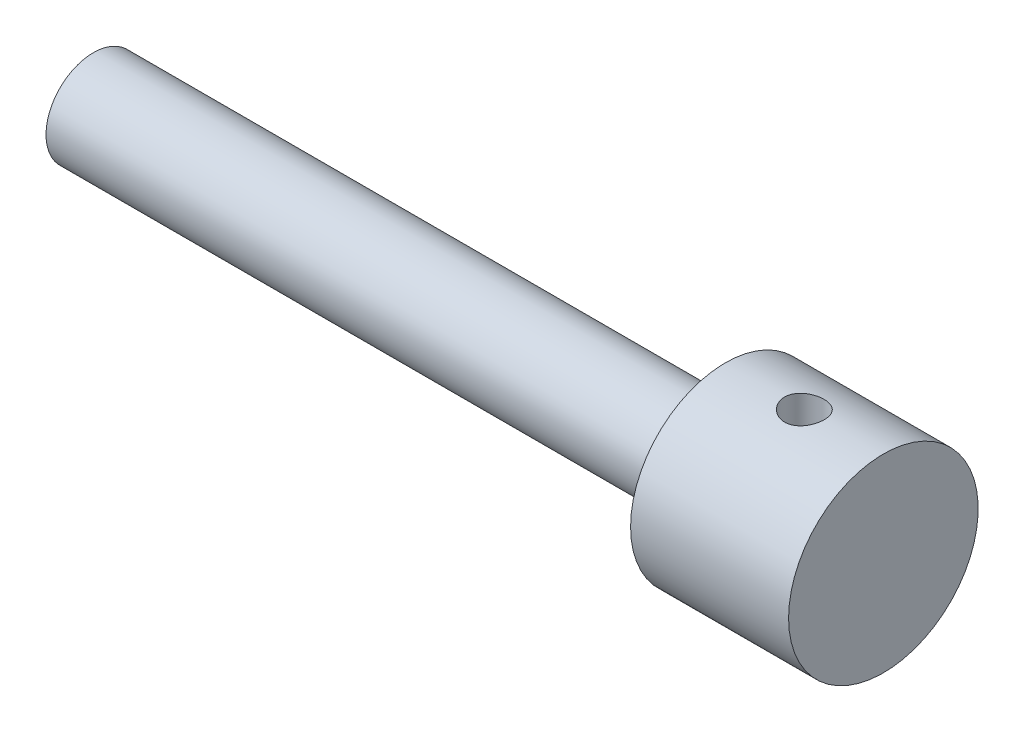
from build123d import *

# Parameters (mm, degrees)
HOLE_WIZARD_5_0_5_1_D           = 5
HOLE_WIZARD_5_0_5_1_ON_FACE_2_D = 5


with BuildPart() as part:
    # 스케치1 → 회전1 (revolve)
    with BuildSketch(Plane.XY, mode=Mode.PRIVATE) as revolve_1_sk:
        Polygon((0, 0), (0, 6), (80, 6), (80, 12), (100, 12), (100, 0), align=None)
    revolve(revolve_1_sk.sketch.rotate(Axis((0, 0, 0), (1, 0, 0)), 90), axis=Axis((0, 0, 0), (1, 0, 0)))

    # Ø5.0 (5) 지름 구멍1 (through all)
    with Locations(Plane(origin=(90, -12, 0), x_dir=(0, 0, -1), z_dir=(0, -1, 0))):
        with Locations((0, 0)):
            Hole(HOLE_WIZARD_5_0_5_1_D / 2)

    # Ø5.0 (5) 지름 구멍1 on face 2 (through all)
    with Locations(Plane(origin=(-101.486732659, 106.473014581, 0), x_dir=(0, 0, -1), z_dir=(0, -1, 0))):
        with Locations((0, 0)):
            Hole(HOLE_WIZARD_5_0_5_1_ON_FACE_2_D / 2)


solid = part.part
